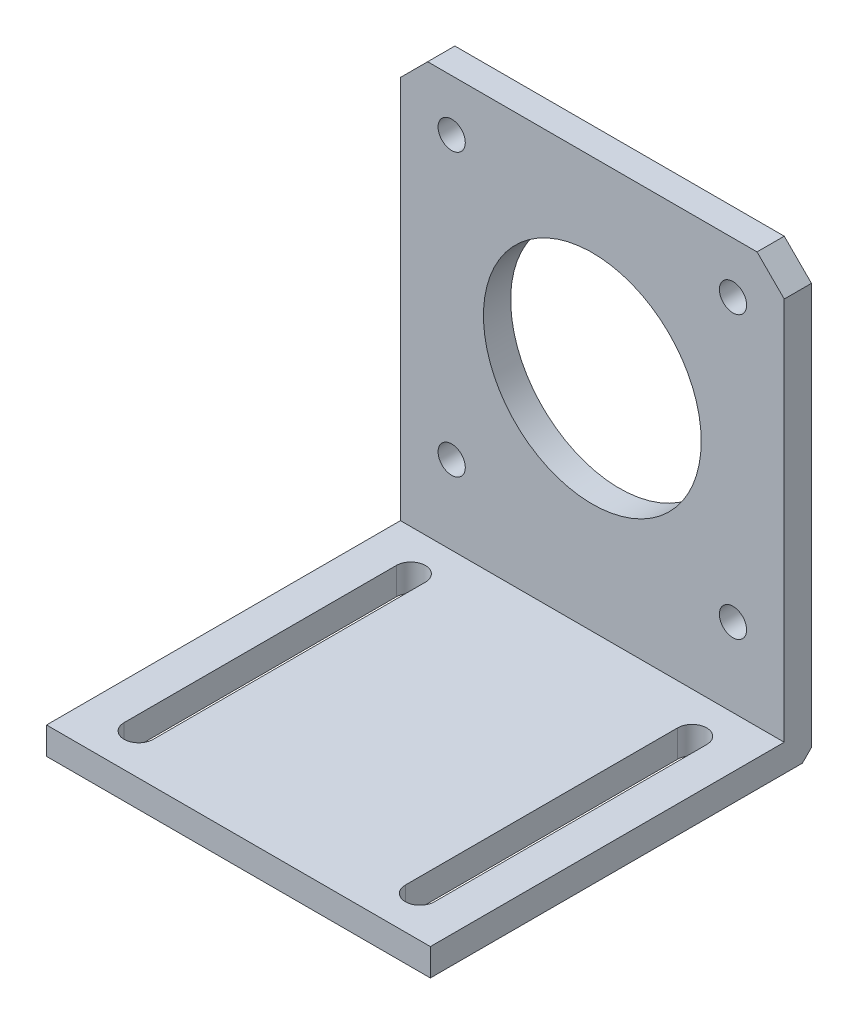
from build123d import *

# Parameters (mm, degrees)
SKETCH1_R           = 1.5
SKETCH1_R_2         = 12
BOSS_EXTRUDE1_DEPTH = 3
BOSS_EXTRUDE2_DEPTH = 3
SKETCH3_W           = 42.3
SKETCH3_H           = 3
BOSS_EXTRUDE3_DEPTH = 39
CHAMFER1_SIZE       = 1
CUT_EXTRUDE1_DEPTH  = 3


with BuildPart() as part:
    # Sketch1 → Boss-Extrude1 (new body)
    with BuildSketch(Plane.XY):
        Polygon((-21.15, 18.15), (-18.15, 21.15), (18.15, 21.15), (21.15, 18.15), (21.15, -18.15), (18.15, -21.15), (-18.15, -21.15), (-21.15, -18.15), align=None)
        with Locations((-15.5, 15.5)):
            Circle(SKETCH1_R, mode=Mode.SUBTRACT)
        with Locations((15.5, 15.5)):
            Circle(SKETCH1_R, mode=Mode.SUBTRACT)
        with Locations((15.5, -15.5)):
            Circle(SKETCH1_R, mode=Mode.SUBTRACT)
        with Locations((-15.5, -15.5)):
            Circle(SKETCH1_R, mode=Mode.SUBTRACT)
        Circle(SKETCH1_R_2, mode=Mode.SUBTRACT)
    extrude(amount=BOSS_EXTRUDE1_DEPTH)

    # Sketch2 → Boss-Extrude2 (add)
    with BuildSketch(Plane(origin=(0, 0, 0), x_dir=(-1, 0, 0), z_dir=(0, 0, -1))):
        Polygon((21.15, -18.15), (18.15, -21.15), (-18.15, -21.15), (-21.15, -18.15), (-21.15, -27.15), (21.15, -27.15), align=None)
    extrude(amount=-BOSS_EXTRUDE2_DEPTH)

    # Sketch3 → Boss-Extrude3 (add)
    with BuildSketch(Plane.XY.offset(3)):
        with Locations((0, -25.65)):
            Rectangle(SKETCH3_W, SKETCH3_H)
    extrude(amount=BOSS_EXTRUDE3_DEPTH)

    # Chamfer1
    chamfer1_edges = [part.edges().sort_by_distance(p)[0] for p in [
        (0, -27.15, 0),
    ]]
    chamfer(chamfer1_edges, length=CHAMFER1_SIZE)

    # Sketch4 → Cut-Extrude1 (cut)
    with BuildSketch(Plane(origin=(0, -24.15, 0), x_dir=(1, 0, 0), z_dir=(0, 1, 0))):
        with BuildLine():
            Line((17.1, -7.5), (17.1, -37.5))
            ThreePointArc((17.1, -37.5), (15.5, -39.1), (13.9, -37.5))
            Line((13.9, -37.5), (13.9, -7.5))
            ThreePointArc((13.9, -7.5), (15.5, -5.9), (17.1, -7.5))
        make_face()
        with BuildLine():
            Line((-17.1, -7.5), (-17.1, -37.5))
            ThreePointArc((-17.1, -37.5), (-15.5, -39.1), (-13.9, -37.5))
            Line((-13.9, -37.5), (-13.9, -7.5))
            ThreePointArc((-13.9, -7.5), (-15.5, -5.9), (-17.1, -7.5))
        make_face()
    extrude(amount=-CUT_EXTRUDE1_DEPTH, mode=Mode.SUBTRACT)


solid = part.part
